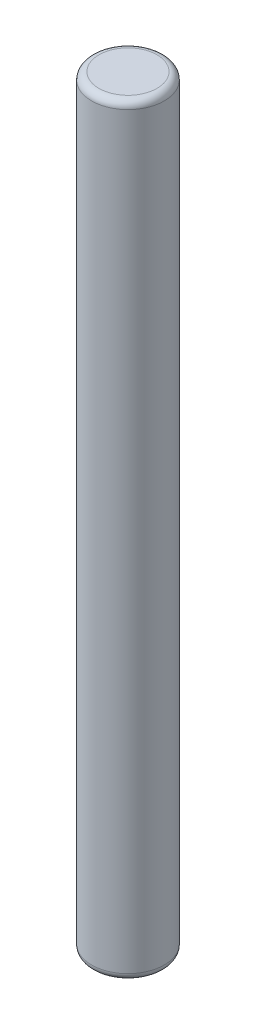
from build123d import *

# Parameters (mm, degrees)
BOSS_EXTRUDE1_DEPTH      = 10
BOSS_EXTRUDE1_DEPTH_BACK = 0.5
SKETCH1_R                = 0.5
FILLET1_R                = 0.1


with BuildPart() as part:
    # Sketch1 → Boss-Extrude1 (new, two sides: drawn at the far end of the back side and taken through both)
    with BuildSketch(Plane(origin=(0, 0, 0), x_dir=(1, 0, 0), z_dir=(0, 1, 0)).offset(-BOSS_EXTRUDE1_DEPTH_BACK)):
        with Locations(Location((0, 0, 0), (0, 0, 270))):
            Circle(SKETCH1_R)
    extrude(amount=BOSS_EXTRUDE1_DEPTH + BOSS_EXTRUDE1_DEPTH_BACK)

    # Fillet1
    fillet1_edges = [part.edges().sort_by_distance(p)[0] for p in [
        (0, 10, -0.5),
        (0, -0.5, -0.5),
    ]]
    fillet(fillet1_edges, radius=FILLET1_R)


solid = part.part
